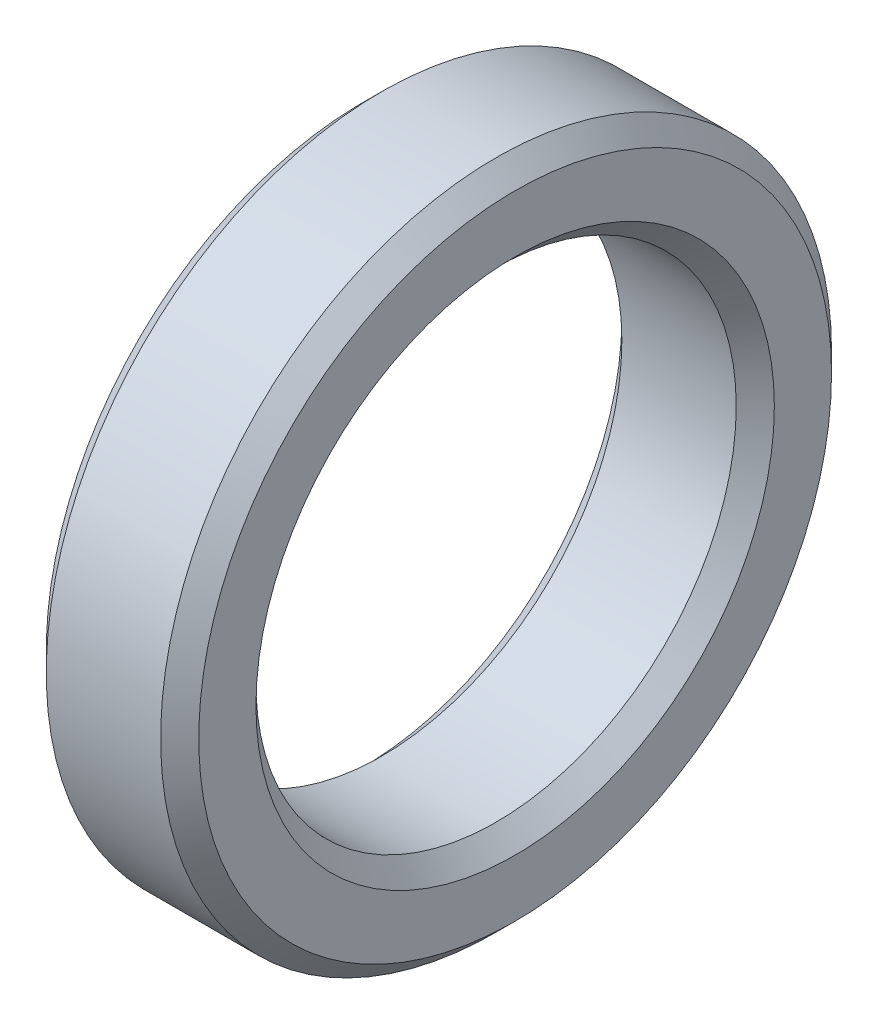
from build123d import *

# Parameters (mm, degrees)
SKETCH1_R           = 8.8
SKETCH1_R_2         = 6.3
BOSS_EXTRUDE1_DEPTH = 4
CHAMFER1_SIZE       = 0.5
CHAMFER2_SIZE       = 0.5


with BuildPart() as part:
    # Sketch1 → Boss-Extrude1 (new body)
    with BuildSketch(Plane(origin=(0, 0, 0), x_dir=(0, 0, -1), z_dir=(1, 0, 0))):
        Circle(SKETCH1_R)
        Circle(SKETCH1_R_2, mode=Mode.SUBTRACT)
    extrude(amount=BOSS_EXTRUDE1_DEPTH)

    # Chamfer1
    chamfer1_edges = [part.edges().sort_by_distance(p)[0] for p in [
        (0, 0, 8.8),
        (4, 0, 8.8),
    ]]
    chamfer(chamfer1_edges, length=CHAMFER1_SIZE)

    # Chamfer2
    chamfer2_edges = [part.edges().sort_by_distance(p)[0] for p in [
        (0, 0, 6.3),
        (4, 0, 6.3),
    ]]
    chamfer(chamfer2_edges, length=CHAMFER2_SIZE)


solid = part.part
